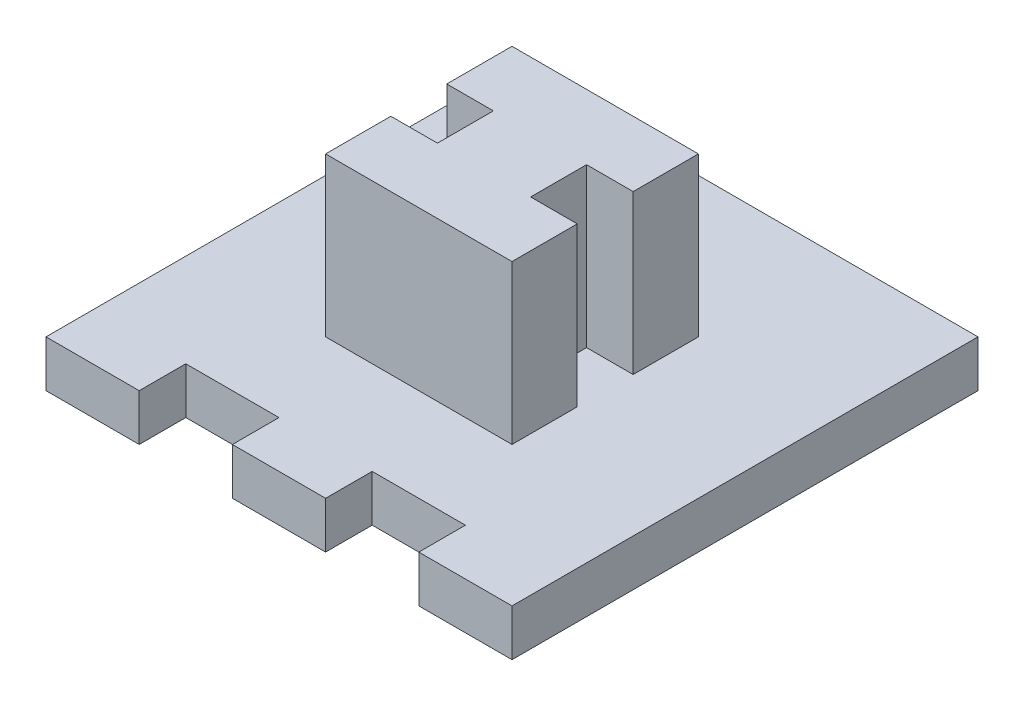
from build123d import *

# Parameters (mm, degrees)
SKETCH1_W           = 100
SKETCH1_H           = 100
BOSS_EXTRUDE1_DEPTH = 10
SKETCH6_W           = 40
SKETCH6_H           = 40
BOSS_EXTRUDE3_DEPTH = 34
SKETCH8_W           = 20
SKETCH8_H           = 10
CUT_EXTRUDE1_DEPTH  = 10
SKETCH9_W           = 20
SKETCH9_H           = 10
CUT_EXTRUDE2_DEPTH  = 10
SKETCH10_W          = 10
SKETCH10_H          = 12
CUT_EXTRUDE3_DEPTH  = 34


with BuildPart() as part:
    # Sketch1 → Boss-Extrude1 (new body)
    with BuildSketch(Plane(origin=(0, 0, 0), x_dir=(1, 0, 0), z_dir=(0, 1, 0))):
        Rectangle(SKETCH1_W, SKETCH1_H)
    extrude(amount=BOSS_EXTRUDE1_DEPTH)

    # Sketch6 → Boss-Extrude3 (add)
    with BuildSketch(Plane(origin=(0, 10, 0), x_dir=(1, 0, 0), z_dir=(0, 1, 0))):
        Rectangle(SKETCH6_W, SKETCH6_H)
    extrude(amount=BOSS_EXTRUDE3_DEPTH)

    # Sketch8 → Cut-Extrude1 (cut)
    with BuildSketch(Plane(origin=(0, 10, 0), x_dir=(1, 0, 0), z_dir=(0, 1, 0))):
        with Locations((-20, -45)):
            Rectangle(SKETCH8_W, SKETCH8_H)
    extrude(amount=-CUT_EXTRUDE1_DEPTH, mode=Mode.SUBTRACT)

    # Sketch9 → Cut-Extrude2 (cut)
    with BuildSketch(Plane(origin=(0, 10, 0), x_dir=(1, 0, 0), z_dir=(0, 1, 0))):
        with Locations((20, -45)):
            Rectangle(SKETCH9_W, SKETCH9_H)
    extrude(amount=-CUT_EXTRUDE2_DEPTH, mode=Mode.SUBTRACT)

    # Sketch10 → Cut-Extrude3 (cut)
    with BuildSketch(Plane(origin=(0, 44, 0), x_dir=(1, 0, 0), z_dir=(0, 1, 0))):
        with Locations((15, 0)):
            Rectangle(SKETCH10_W, SKETCH10_H)
        with Locations((-15, 0)):
            Rectangle(SKETCH10_W, SKETCH10_H)
    extrude(amount=-CUT_EXTRUDE3_DEPTH, mode=Mode.SUBTRACT)


solid = part.part
